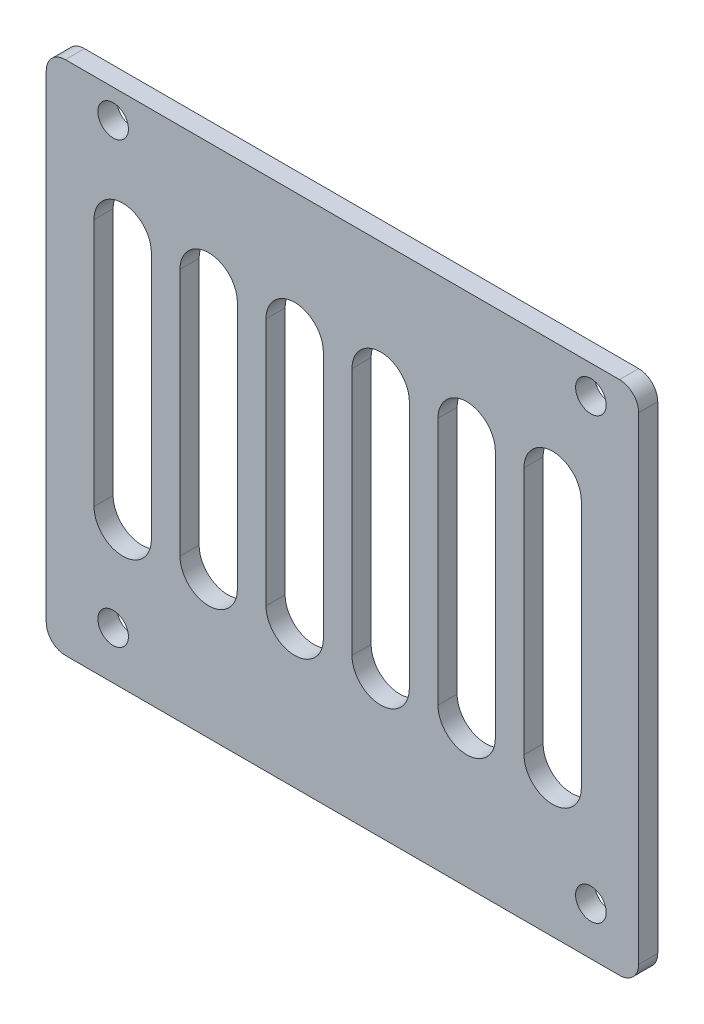
from build123d import *

# Parameters (mm, degrees)
SKETCH_1_R      = 1.6
EXTRUDE_1_DEPTH = 2


with BuildPart() as part:
    # 草图1 → 凸台-拉伸1 (new body)
    with BuildSketch(Plane.XY):
        with BuildLine():
            Line((0, -28), (58, -28))
            ThreePointArc((58, -28), (59.414213562, -27.414213562), (60, -26))
            Line((60, -26), (60, 24))
            ThreePointArc((60, 24), (59.414213562, 25.414213562), (58, 26))
            Line((58, 26), (0, 26))
            ThreePointArc((0, 26), (-1.414213562, 25.414213562), (-2, 24))
            Line((-2, 24), (-2, -26))
            ThreePointArc((-2, -26), (-1.414213562, -27.414213562), (0, -28))
        make_face()
        with Locations((5, 23)):
            Circle(SKETCH_1_R, mode=Mode.SUBTRACT)
        with Locations((55, 23)):
            Circle(SKETCH_1_R, mode=Mode.SUBTRACT)
        with Locations((55, -23)):
            Circle(SKETCH_1_R, mode=Mode.SUBTRACT)
        with Locations((5, -23)):
            Circle(SKETCH_1_R, mode=Mode.SUBTRACT)
        with BuildLine():
            Line((9, 13), (9, -13))
            ThreePointArc((9, -13), (6, -16), (3, -13))
            Line((3, -13), (3, 13))
            ThreePointArc((3, 13), (6, 16), (9, 13))
        make_face(mode=Mode.SUBTRACT)
        with BuildLine():
            Line((18, 13), (18, -13))
            ThreePointArc((18, -13), (15, -16), (12, -13))
            Line((12, -13), (12, 13))
            ThreePointArc((12, 13), (15, 16), (18, 13))
        make_face(mode=Mode.SUBTRACT)
        with BuildLine():
            Line((27, 13), (27, -13))
            ThreePointArc((27, -13), (24, -16), (21, -13))
            Line((21, -13), (21, 13))
            ThreePointArc((21, 13), (24, 16), (27, 13))
        make_face(mode=Mode.SUBTRACT)
        with BuildLine():
            Line((36, 13), (36, -13))
            ThreePointArc((36, -13), (33, -16), (30, -13))
            Line((30, -13), (30, 13))
            ThreePointArc((30, 13), (33, 16), (36, 13))
        make_face(mode=Mode.SUBTRACT)
        with BuildLine():
            Line((45, 13), (45, -13))
            ThreePointArc((45, -13), (42, -16), (39, -13))
            Line((39, -13), (39, 13))
            ThreePointArc((39, 13), (42, 16), (45, 13))
        make_face(mode=Mode.SUBTRACT)
        with BuildLine():
            Line((54, 13), (54, -13))
            ThreePointArc((54, -13), (51, -16), (48, -13))
            Line((48, -13), (48, 13))
            ThreePointArc((48, 13), (51, 16), (54, 13))
        make_face(mode=Mode.SUBTRACT)
    extrude(amount=EXTRUDE_1_DEPTH)


solid = part.part
